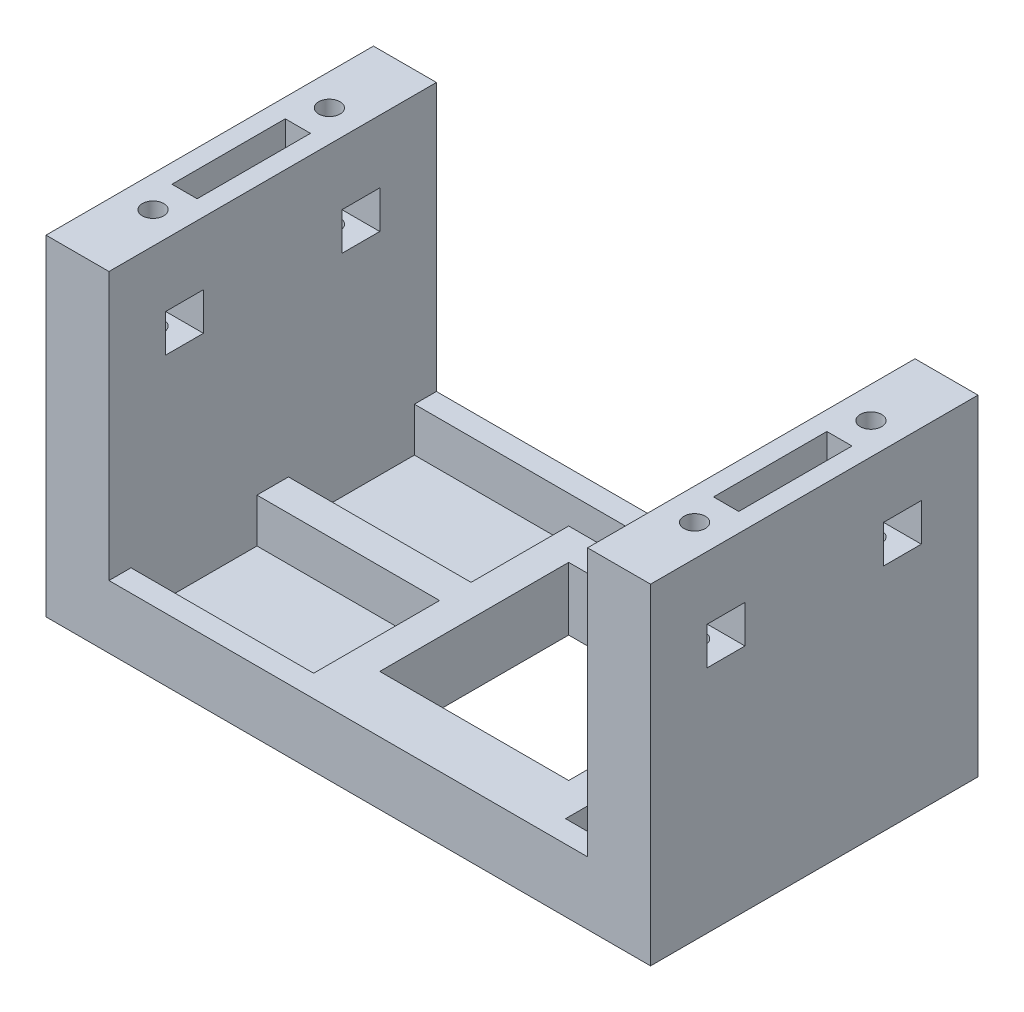
from build123d import *

# Parameters (mm, degrees)
SKETCH1_W           = 96
SKETCH1_H           = 52
BOSS_EXTRUDE1_DEPTH = 10
SKETCH3_W           = 30
SKETCH3_H           = 30
CUT_EXTRUDE1_DEPTH  = 10
SKETCH4_W           = 10
SKETCH4_H           = 52
BOSS_EXTRUDE2_DEPTH = 42.5
CUT_EXTRUDE2_DEPTH  = 25
SKETCH10_W          = 6
SKETCH10_H          = 6
CUT_EXTRUDE7_DEPTH  = 113.464438824
SKETCH11_R          = 1.7
SKETCH11_W          = 4
SKETCH11_H          = 18
CUT_EXTRUDE8_DEPTH  = 60
SKETCH14_W          = 96
SKETCH14_H          = 52
SKETCH14_W_2        = 30
SKETCH14_H_2        = 30
BOSS_EXTRUDE3_DEPTH = 3


with BuildPart() as part:
    # Sketch1 → Boss-Extrude1 (new body)
    with BuildSketch(Plane(origin=(0, 0, 0), x_dir=(1, 0, 0), z_dir=(0, 1, 0))):
        with Locations((-13, 0)):
            Rectangle(SKETCH1_W, SKETCH1_H)
    extrude(amount=BOSS_EXTRUDE1_DEPTH)

    # Sketch3 → Cut-Extrude1 (cut)
    with BuildSketch(Plane(origin=(0, 10, 0), x_dir=(1, 0, 0), z_dir=(0, 1, 0))):
        with Locations((-2, -2)):
            Rectangle(SKETCH3_W, SKETCH3_H)
    extrude(amount=-CUT_EXTRUDE1_DEPTH, mode=Mode.SUBTRACT)

    # Sketch4 → Boss-Extrude2 (add)
    with BuildSketch(Plane(origin=(0, 10, 0), x_dir=(1, 0, 0), z_dir=(0, 1, 0))):
        with Locations((30, 0)):
            Rectangle(SKETCH4_W, SKETCH4_H)
        with Locations((-56, 0)):
            Rectangle(SKETCH4_W, SKETCH4_H)
    extrude(amount=BOSS_EXTRUDE2_DEPTH)

    # Sketch5 → Cut-Extrude2 (cut)
    with BuildSketch(Plane(origin=(0, 10, 0), x_dir=(1, 0, 0), z_dir=(0, 1, 0))):
        Polygon((25, 22.5), (0.5, 22.5), (0.5, 18), (18, 18), (18, 2.5), (25, 2.5), align=None)
        Polygon((-4.5, 22.5), (-51, 22.5), (-51, 2.5), (-22, 2.5), (-22, 18), (-4.5, 18), align=None)
        Polygon((-22, -2.5), (-51, -2.5), (-51, -22.5), (-22, -22.5), (-22, -20), align=None)
        Polygon((25, -22.5), (25, -2.5), (18, -2.5), (18, -20), (18, -22.5), align=None)
    extrude(amount=-CUT_EXTRUDE2_DEPTH, mode=Mode.SUBTRACT)

    # Sketch10 → Cut-Extrude7 (cut, through all)
    with BuildSketch(Plane(origin=(35, 0, 0), x_dir=(0, 0, -1), z_dir=(1, 0, 0))):
        with Locations((14, 39.5)):
            Rectangle(SKETCH10_W, SKETCH10_H)
        with Locations((-14, 39.5)):
            Rectangle(SKETCH10_W, SKETCH10_H)
    extrude(amount=-CUT_EXTRUDE7_DEPTH, mode=Mode.SUBTRACT)

    # Sketch11 → Cut-Extrude8 (cut)
    with BuildSketch(Plane(origin=(0, 52.5, 0), x_dir=(1, 0, 0), z_dir=(0, 1, 0))):
        with Locations(Location((-56, 14, 0), (0, 0, 270))):
            Circle(SKETCH11_R)
        with Locations(Location((-56, -14, 0), (0, 0, 270))):
            Circle(SKETCH11_R)
        with Locations(Location((30, -14, 0), (0, 0, 270))):
            Circle(SKETCH11_R)
        with Locations(Location((30, 14, 0), (0, 0, 270))):
            Circle(SKETCH11_R)
        with Locations((-56, 0)):
            Rectangle(SKETCH11_W, SKETCH11_H)
        with Locations((30, 0)):
            Rectangle(SKETCH11_W, SKETCH11_H)
    extrude(amount=-CUT_EXTRUDE8_DEPTH, mode=Mode.SUBTRACT)

    # Sketch14 → Boss-Extrude3 (add)
    with BuildSketch(Plane.XZ):
        with Locations((-13, 0)):
            Rectangle(SKETCH14_W, SKETCH14_H)
        with Locations((-2, 2)):
            Rectangle(SKETCH14_W_2, SKETCH14_H_2, mode=Mode.SUBTRACT)
    extrude(amount=-BOSS_EXTRUDE3_DEPTH)


solid = part.part
